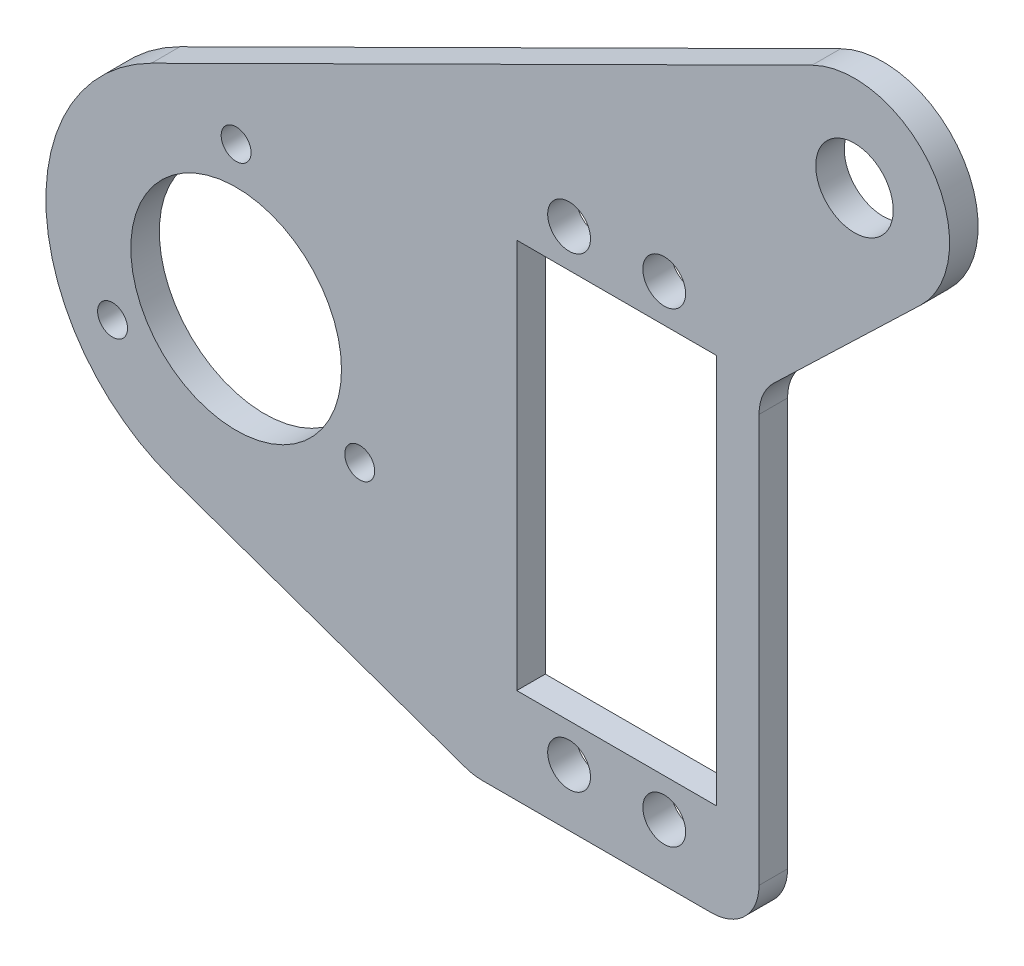
from build123d import *

# Parameters (mm, degrees)
SKETCH1_R               = 11.075
SKETCH1_R_2             = 4.075
BOSS_EXTRUDE1_DEPTH     = 3
CUT_EXTRUDE1_DEPTH      = 93.175105099
CUT_EXTRUDE1_DEPTH_BACK = 93.175105099
SKETCH2_R               = 1.575
CUT_EXTRUDE5_DEPTH      = 93.175105099
CUT_EXTRUDE5_DEPTH_BACK = 93.175105099
SKETCH6_R               = 2.25
FILLET2_R               = 5
CUT_EXTRUDE6_DEPTH      = 93.175105099
CUT_EXTRUDE6_DEPTH_BACK = 93.175105099
SKETCH7_W               = 21
SKETCH7_H               = 41


with BuildPart() as part:
    # Sketch1 → Boss-Extrude1 (new body)
    with BuildSketch(Plane.XY):
        with BuildLine():
            Line((24.96497351, -30), (-6.645635057, -18.863603439))
            ThreePointArc((-6.645635057, -18.863603439), (-19.962283564, -1.227694959), (-8.907060148, 17.907101371))
            Line((-8.907060148, 17.907101371), (60.546469926, 52.453550686))
            ThreePointArc((60.546469926, 52.453550686), (73.177271821, 49.256059899), (71.926246808, 36.28701829))
            Line((71.926246808, 36.28701829), (54.96497351, 20))
            Line((54.96497351, 20), (54.96497351, -30))
            Line((54.96497351, -30), (24.96497351, -30))
        make_face()
        Circle(SKETCH1_R, mode=Mode.SUBTRACT)
        with Locations((65, 43.5)):
            Circle(SKETCH1_R_2, mode=Mode.SUBTRACT)
    extrude(amount=BOSS_EXTRUDE1_DEPTH)

    # Sketch2 → Cut-Extrude1 (cut, two sides: drawn at the far end of the back side and taken through both)
    with BuildSketch(Plane.XY.offset(-CUT_EXTRUDE1_DEPTH_BACK)):
        with Locations((0, 15)):
            Circle(SKETCH2_R)
        with Locations((12.990381057, -7.5)):
            Circle(SKETCH2_R)
        with Locations((-12.990381057, -7.5)):
            Circle(SKETCH2_R)
    extrude(amount=CUT_EXTRUDE1_DEPTH + CUT_EXTRUDE1_DEPTH_BACK, mode=Mode.SUBTRACT)

    # Sketch6 → Cut-Extrude5 (cut, two sides: drawn at the far end of the back side and taken through both)
    with BuildSketch(Plane.XY.offset(-CUT_EXTRUDE5_DEPTH_BACK)):
        with Locations((35, -24)):
            Circle(SKETCH6_R)
        with Locations((35, 25)):
            Circle(SKETCH6_R)
        with Locations(Location((45, 25, 0), (0, 0, 180))):
            Circle(SKETCH6_R)
        with Locations(Location((45, -24, 0), (0, 0, 180))):
            Circle(SKETCH6_R)
    extrude(amount=CUT_EXTRUDE5_DEPTH + CUT_EXTRUDE5_DEPTH_BACK, mode=Mode.SUBTRACT)

    # Fillet2
    fillet2_edges = [part.edges().sort_by_distance(p)[0] for p in [
        (54.96497351, -30, 1.5),
        (24.96497351, -30, 1.5),
        (54.96497351, 20, 1.5),
    ]]
    fillet(fillet2_edges, radius=FILLET2_R)

    # Sketch7 → Cut-Extrude6 (cut, two sides: drawn at the far end of the back side and taken through both)
    with BuildSketch(Plane.XY.offset(-CUT_EXTRUDE6_DEPTH_BACK)):
        with Locations((40, 0.5)):
            Rectangle(SKETCH7_W, SKETCH7_H)
    extrude(amount=CUT_EXTRUDE6_DEPTH + CUT_EXTRUDE6_DEPTH_BACK, mode=Mode.SUBTRACT)


solid = part.part
